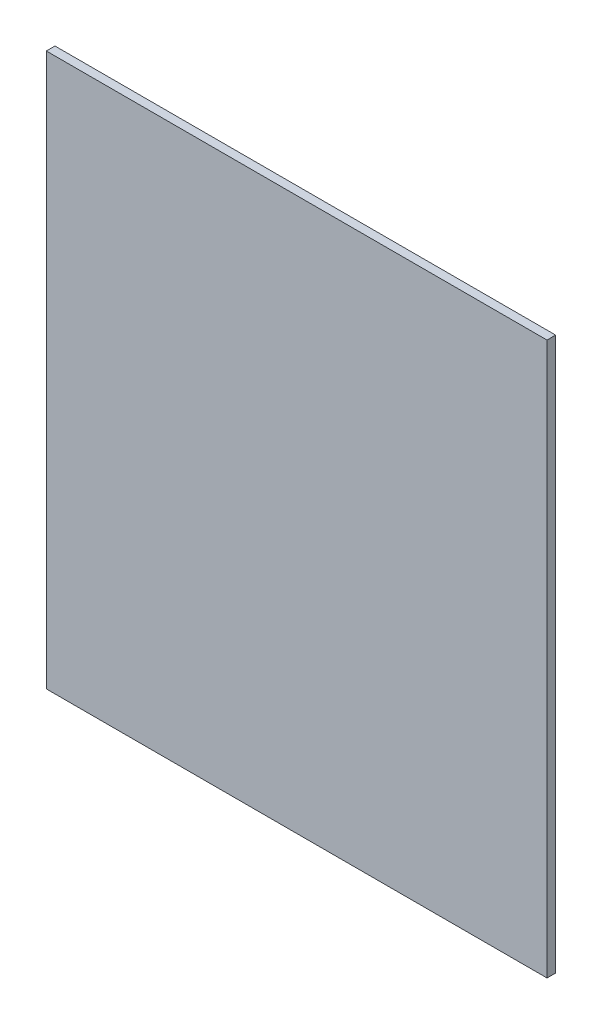
from build123d import *

# Parameters (mm, degrees)
ESQUISSE1_W        = 290
ESQUISSE1_H        = 320
BOSS_EXTRU_1_DEPTH = 5


with BuildPart() as part:
    # Esquisse1 → Boss.-Extru.1 (new body)
    with BuildSketch(Plane.XY):
        with Locations((145, 160)):
            Rectangle(ESQUISSE1_W, ESQUISSE1_H)
    extrude(amount=BOSS_EXTRU_1_DEPTH)


solid = part.part
